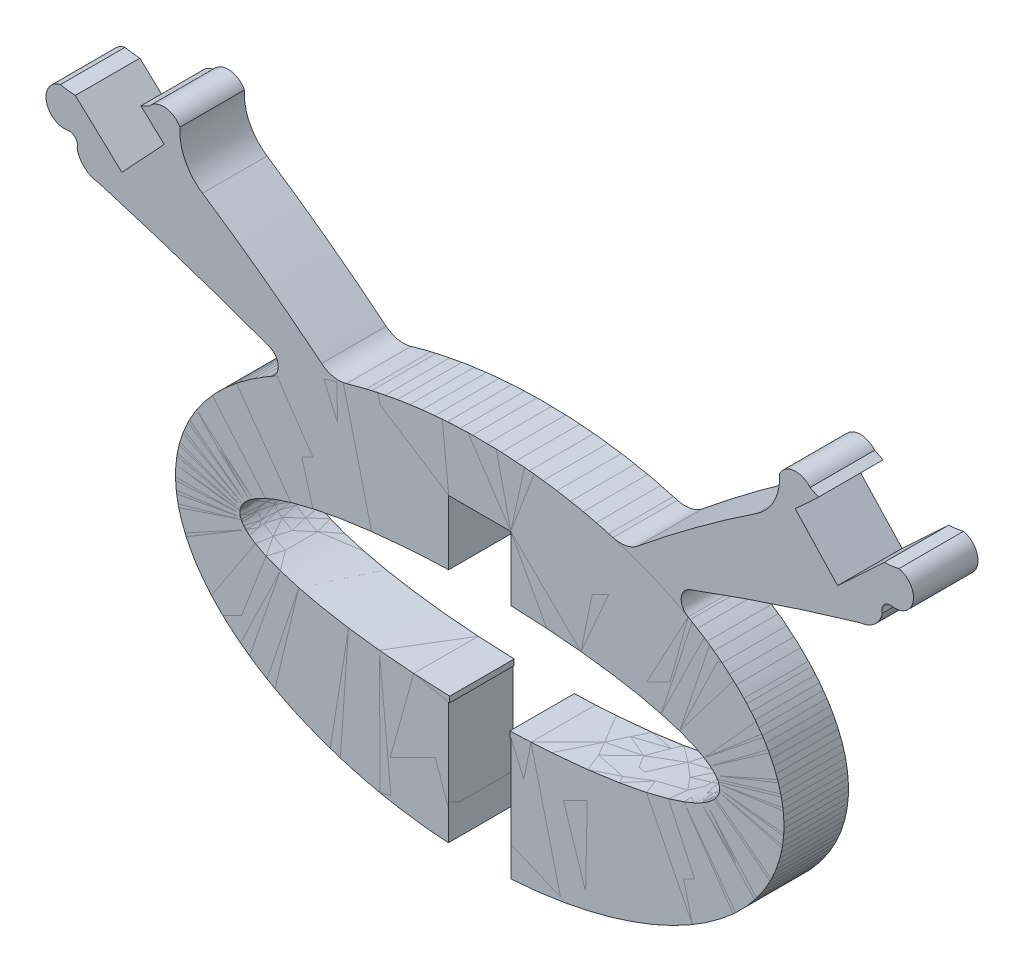
from build123d import *

# Parameters (mm, degrees)
EXTRUDE_1_DEPTH     = 3
EXTRUDE_2_DEPTH     = 3.01
CUT_EXTRUDE_1_DEPTH = 3.01
CUT_EXTRUDE_START   = -3.01
SKETCH_5_W          = 2.925
SKETCH_5_H          = 7.367729242
CUT_EXTRUDE_2_DEPTH = 3.01
FILLET_1_R          = 1.27
FILLET_2_R          = 0.635


with BuildPart() as part:
    # 스케치1 → 보스-돌출1 (new body)
    with BuildSketch(Plane.XY):
        with BuildLine():
            Line((-1.4475, 2.54), (-1.4475, 5.54))
            Line((-1.4475, 5.54), (1.4475, 5.54))
            Line((1.4475, 5.54), (1.4475, 2.54))
            add(Edge.make_bspline(
                [(1.401888609, -2.541340514), (11.168620646, -2.258966545), (11.188850448, -0.005263871), (11.20908025, 2.248438804), (1.4475, 2.54)],
                knots=[1.696419571, 1.696419571, 1.696419571, 3.139537677, 3.139537677, 4.582655784, 4.582655784, 4.582655784], degree=2, weights=[1, 0.7507768, 1, 0.7507768, 1]))
            Line((1.401888609, -2.541340514), (1.401888609, -8.49821477))
            add(Edge.make_bspline(
                [(1.401888609, -8.49821477), (24.09450539, -7.142119328), (12.047252695, 4.511605769), (0, 16.165330867), (-12.047252695, 4.511605769), (-24.09450539, -7.142119328), (-1.401888609, -8.49821477)],
                knots=[1.669759748, 1.669759748, 1.669759748, 3.698179236, 3.698179236, 5.726598725, 5.726598725, 7.755018213, 7.755018213, 7.755018213], degree=2, weights=[1, 0.528291074, 1, 0.528291074, 1, 0.528291074, 1]))
            Line((-1.401888609, -8.49821477), (-1.401888609, -2.541340514))
            add(Edge.make_bspline(
                [(-1.4475, 2.54), (-11.20908025, 2.248438804), (-11.188850448, -0.005263871), (-11.168620646, -2.258966545), (-1.401888609, -2.541340514)],
                knots=[4.842122176, 4.842122176, 4.842122176, 6.285240283, 6.285240283, 7.72835839, 7.72835839, 7.72835839], degree=2, weights=[1, 0.7507768, 1, 0.7507768, 1]))
        make_face()
    extrude(amount=EXTRUDE_1_DEPTH)


with BuildPart() as body_2:
    # 스케치3 → 보스-돌출2 (new body)
    with BuildSketch(Plane.XY.offset(3)):
        with BuildLine():
            Line((1.4475, 5.54), (1.4475, 2.54))
            add(Edge.make_bspline(
                [(1.401888609, -2.541340514), (11.168620646, -2.258966545), (11.188850448, -0.005263871), (11.20908025, 2.248438804), (1.4475, 2.54)],
                knots=[1.696419571, 1.696419571, 1.696419571, 3.139537677, 3.139537677, 4.582655784, 4.582655784, 4.582655784], degree=2, weights=[1, 0.7507768, 1, 0.7507768, 1]))
            Line((1.401888609, -2.541340514), (1.401888609, -8.49821477))
            add(Edge.make_bspline(
                [(1.401888609, -8.49821477), (37.960615837, -6.313489939), (8.452643499, 6.85924006)],
                knots=[1.669759748, 1.669759748, 1.669759748, 4.074223044, 4.074223044, 4.074223044], degree=2, weights=[1, 0.360276871, 1]))
            ThreePointArc((8.452643499, 6.85924006), (13.088018456, 8.528816455), (17.78715406, 10.009461891))
            ThreePointArc((17.78715406, 10.009461891), (18.429015287, 10.288984292), (18.777890424, 10.895947839))
            ThreePointArc((18.777890424, 10.895947839), (18.846068424, 11.268375796), (19.196328594, 11.412141704))
            ThreePointArc((19.196328594, 11.412141704), (20.211414767, 12.072545317), (19.552915533, 13.088867918))
            ThreePointArc((19.552915533, 13.088867918), (19.002584974, 13.002283135), (18.445485889, 13.003404741))
            ThreePointArc((18.445485889, 13.003404741), (16.909016091, 13.605087239), (15.408848907, 14.292298771))
            ThreePointArc((15.408848907, 14.292298771), (14.65837183, 14.600982934), (13.982625364, 14.151685182))
            ThreePointArc((13.982625364, 14.151685182), (13.745441378, 12.937715208), (12.929366611, 12.008198498))
            ThreePointArc((12.929366611, 12.008198498), (9.829159643, 9.825309313), (6.851110926, 7.478499929))
            add(Edge.make_bspline(
                [(6.851110926, 7.478499929), (0, 9.752169645), (-6.851110926, 7.478499929)],
                knots=[4.208481597, 4.208481597, 4.208481597, 5.216296364, 5.216296364, 5.216296364], degree=2, weights=[1, 0.875702568, 1]))
            ThreePointArc((-6.851110926, 7.478499929), (-9.829159643, 9.825309313), (-12.929366611, 12.008198498))
            ThreePointArc((-12.929366611, 12.008198498), (-13.745441378, 12.937715208), (-13.982625364, 14.151685182))
            ThreePointArc((-13.982625364, 14.151685182), (-14.65837183, 14.600982934), (-15.408848907, 14.292298771))
            ThreePointArc((-15.408848907, 14.292298771), (-16.909016091, 13.605087239), (-18.445485889, 13.003404741))
            ThreePointArc((-18.445485889, 13.003404741), (-19.002584974, 13.002283135), (-19.552915533, 13.088867918))
            ThreePointArc((-19.552915533, 13.088867918), (-20.211414767, 12.072545317), (-19.196328594, 11.412141704))
            ThreePointArc((-19.196328594, 11.412141704), (-18.846068424, 11.268375796), (-18.777890424, 10.895947839))
            ThreePointArc((-18.777890424, 10.895947839), (-18.429015287, 10.288984292), (-17.78715406, 10.009461891))
            ThreePointArc((-17.78715406, 10.009461891), (-13.088018456, 8.528816455), (-8.452643499, 6.85924006))
            add(Edge.make_bspline(
                [(-8.452643499, 6.85924006), (-37.960615837, -6.313489939), (-1.401888609, -8.49821477)],
                knots=[5.350554917, 5.350554917, 5.350554917, 7.755018213, 7.755018213, 7.755018213], degree=2, weights=[1, 0.360276871, 1]))
            Line((-1.401888609, -8.49821477), (-1.401888609, -2.541340514))
            add(Edge.make_bspline(
                [(-1.4475, 2.54), (-11.20908025, 2.248438804), (-11.188850448, -0.005263871), (-11.168620646, -2.258966545), (-1.401888609, -2.541340514)],
                knots=[4.842122176, 4.842122176, 4.842122176, 6.285240283, 6.285240283, 7.72835839, 7.72835839, 7.72835839], degree=2, weights=[1, 0.7507768, 1, 0.7507768, 1]))
            Line((-1.4475, 2.54), (-1.4475, 5.54))
            Line((-1.4475, 5.54), (1.4475, 5.54))
        make_face()
    extrude(amount=-EXTRUDE_2_DEPTH)

    # 스케치4 → 컷-돌출1 (cut)
    with BuildSketch(Plane(origin=(0, 0, -0.01), x_dir=(-1, 0, 0), z_dir=(0, 0, -1))):
        Polygon((-16.690197045, 10.970952498), (-14.716721607, 13.089069515), (-16.911661522, 15.134121782), (-18.885136959, 13.016004764), align=None)
        Polygon((14.716721607, 13.089069515), (16.911661522, 15.134121782), (18.885136959, 13.016004764), (16.690197045, 10.970952498), align=None)
    extrude(amount=-CUT_EXTRUDE_1_DEPTH, mode=Mode.SUBTRACT)


with BuildPart() as cut_extrude_2_tool:
    # 스케치5 → 컷-돌출2 (new body)
    with BuildSketch(Plane.XY.offset(3).offset(CUT_EXTRUDE_START)):
        with Locations((0, -6.495271399)):
            Rectangle(SKETCH_5_W, SKETCH_5_H)
    extrude(amount=CUT_EXTRUDE_2_DEPTH)


with BuildPart() as part_1:
    add(part.part)

    # 컷-돌출2: cut by cut_extrude_2_tool
    add(cut_extrude_2_tool.part, mode=Mode.SUBTRACT)


with BuildPart() as body_2_1:
    add(body_2.part)

    # 컷-돌출2: cut by cut_extrude_2_tool
    add(cut_extrude_2_tool.part, mode=Mode.SUBTRACT)

    # 필렛1
    fillet_1_edges = [body_2_1.edges().sort_by_distance(p)[0] for p in [
        (-6.851110926, 7.478499929, 1.495),
        (6.851110926, 7.478499929, 1.495),
        (-1.4625, -8.494513567, 1.495),
        (1.4625, -8.494513567, 1.495),
    ]]
    fillet(fillet_1_edges, radius=FILLET_1_R)

    # 필렛2
    fillet_2_edges = [body_2_1.edges().sort_by_distance(p)[0] for p in [
        (8.452643499, 6.85924006, 1.495),
        (-8.452643499, 6.85924006, 1.495),
    ]]
    fillet(fillet_2_edges, radius=FILLET_2_R)


solid = Compound([part_1.part, body_2_1.part])
